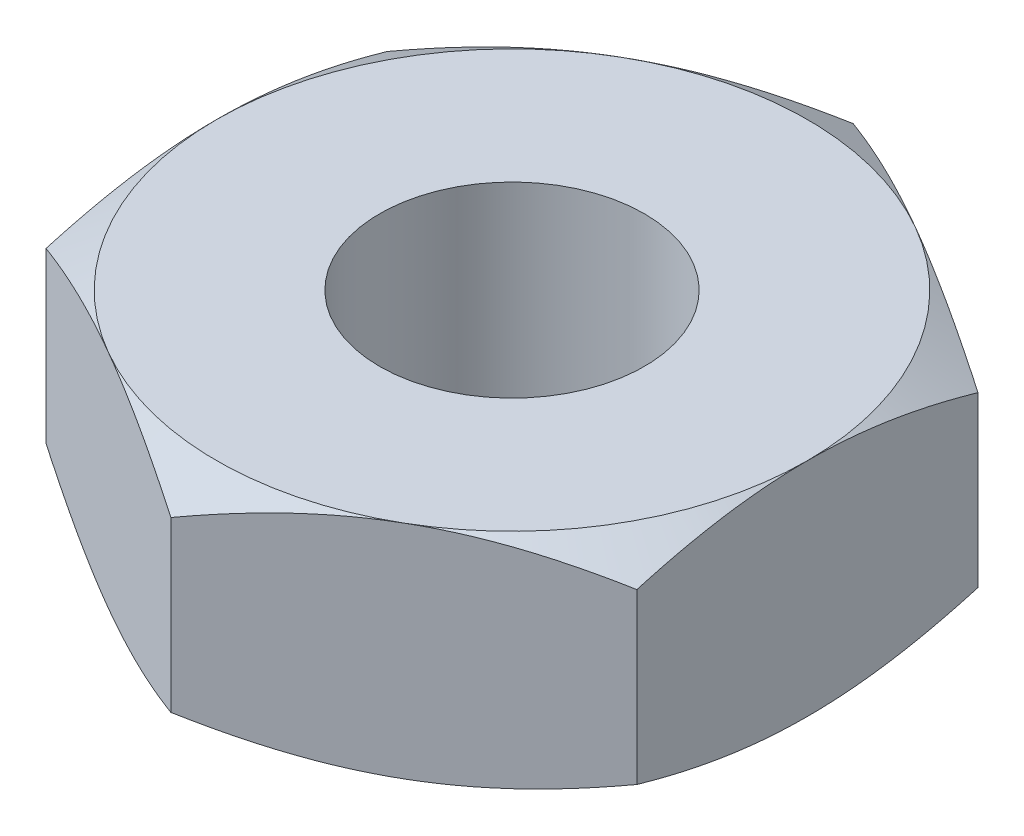
from build123d import *

# Parameters (mm, degrees)
SKETCH1_R               = 1.4224
BOSS_EXTRUDE1_DEPTH     = 1.190625
SKETCH5_OUTSIDE_W       = 32.528
SKETCH5_OUTSIDE_H       = 33.51
SKETCH5_OUTSIDE_R       = 3.175
CUT_EXTRUDE2_DEPTH      = 6.402944558
CUT_EXTRUDE2_DRAFT      = -60
MIRROR1_COPY_1_SKETCH_W = 32.528
MIRROR1_COPY_1_SKETCH_H = 33.51
MIRROR1_COPY_1_SKETCH_R = 3.175
MIRROR1_COPY_1_DEPTH    = 6.402944558
MIRROR1_COPY_1_DRAFT    = -60


with BuildPart() as part:
    # Sketch1 → Boss-Extrude1 (new, symmetric)
    with BuildSketch(Plane(origin=(0, 0, 0), x_dir=(1, 0, 0), z_dir=(0, 1, 0))):
        Polygon((-3.175, 1.833087105), (-3.175, -1.833087105), (0, -3.666174209), (3.175, -1.833087105), (3.175, 1.833087105), (0, 3.666174209), align=None)
        Circle(SKETCH1_R, mode=Mode.SUBTRACT)
    extrude(amount=BOSS_EXTRUDE1_DEPTH, both=True)


with BuildPart() as cut_extrude2_tool:
    # Sketch5 outside → Cut-Extrude2 (with draft: the straight prism first)
    with BuildSketch(Plane(origin=(0, 1.190625, 0), x_dir=(1, 0, 0), z_dir=(0, 1, 0))):
        Rectangle(SKETCH5_OUTSIDE_W, SKETCH5_OUTSIDE_H)
        Circle(SKETCH5_OUTSIDE_R, mode=Mode.SUBTRACT)
    extrude(amount=-CUT_EXTRUDE2_DEPTH)
    # Cut-Extrude2: the draft: its side faces are tilted about the plane it starts from
    cut_extrude2_sides = [cut_extrude2_tool.faces().sort_by_distance(p)[0] for p in [
        (0, -2.010847279, 16.755),
        (16.264, -2.010847279, 0),
        (0, -2.010847279, -16.755),
        (-16.264, -2.010847279, 0),
        (-3.175, -2.010847279, 0),
    ]]
    draft(cut_extrude2_sides, Plane(origin=(0, 1.190625, 0), x_dir=(1, 0, 0), z_dir=(0, 1, 0)), CUT_EXTRUDE2_DRAFT)


with BuildPart() as part_1:
    add(part.part)

    # Cut-Extrude2: cut by cut_extrude2_tool
    add(cut_extrude2_tool.part, mode=Mode.SUBTRACT)


with BuildPart() as mirror1_copy_1_tool:
    # Mirror1 copy 1 sketch → Mirror1 copy 1 (with draft: the straight prism first)
    with BuildSketch(Plane.XZ.offset(1.190625)):
        Rectangle(MIRROR1_COPY_1_SKETCH_W, MIRROR1_COPY_1_SKETCH_H)
        Circle(MIRROR1_COPY_1_SKETCH_R, mode=Mode.SUBTRACT)
    extrude(amount=-MIRROR1_COPY_1_DEPTH)
    # Mirror1 copy 1: the draft: its side faces are tilted about the plane it starts from
    mirror1_copy_1_sides = [mirror1_copy_1_tool.faces().sort_by_distance(p)[0] for p in [
        (0, 2.010847279, 16.755),
        (16.264, 2.010847279, 0),
        (0, 2.010847279, -16.755),
        (-16.264, 2.010847279, 0),
        (-3.175, 2.010847279, 0),
    ]]
    draft(mirror1_copy_1_sides, Plane.XZ.offset(1.190625), MIRROR1_COPY_1_DRAFT)


with BuildPart() as part_2:
    add(part_1.part)

    # Mirror1 copy 1: cut by mirror1_copy_1_tool
    add(mirror1_copy_1_tool.part, mode=Mode.SUBTRACT)


solid = part_2.part
